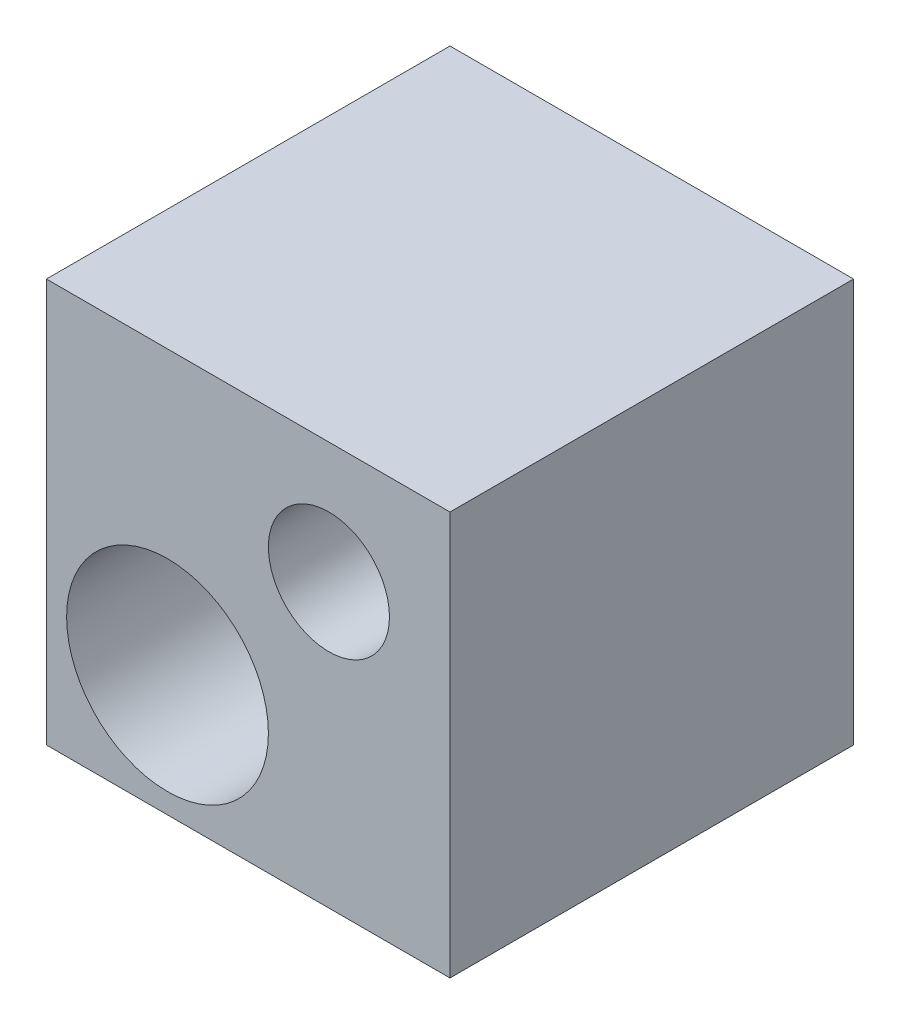
from build123d import *

# Parameters (mm, degrees)
SKETCH1_W           = 10
SKETCH1_H           = 10
BOSS_EXTRUDE1_DEPTH = 10
SKETCH2_R           = 2.5
SKETCH2_R_2         = 1.5
CUT_EXTRUDE2_DEPTH  = 18.320508076


with BuildPart() as part:
    # Sketch1 → Boss-Extrude1 (new body)
    with BuildSketch(Plane.XY):
        with Locations((5, 5)):
            Rectangle(SKETCH1_W, SKETCH1_H)
    extrude(amount=BOSS_EXTRUDE1_DEPTH)

    # Sketch2 → Cut-Extrude2 (cut, through all)
    with BuildSketch(Plane.XY):
        with Locations((3, 3)):
            Circle(SKETCH2_R)
        with Locations((7, 7)):
            Circle(SKETCH2_R_2)
    extrude(amount=CUT_EXTRUDE2_DEPTH, mode=Mode.SUBTRACT)


solid = part.part
